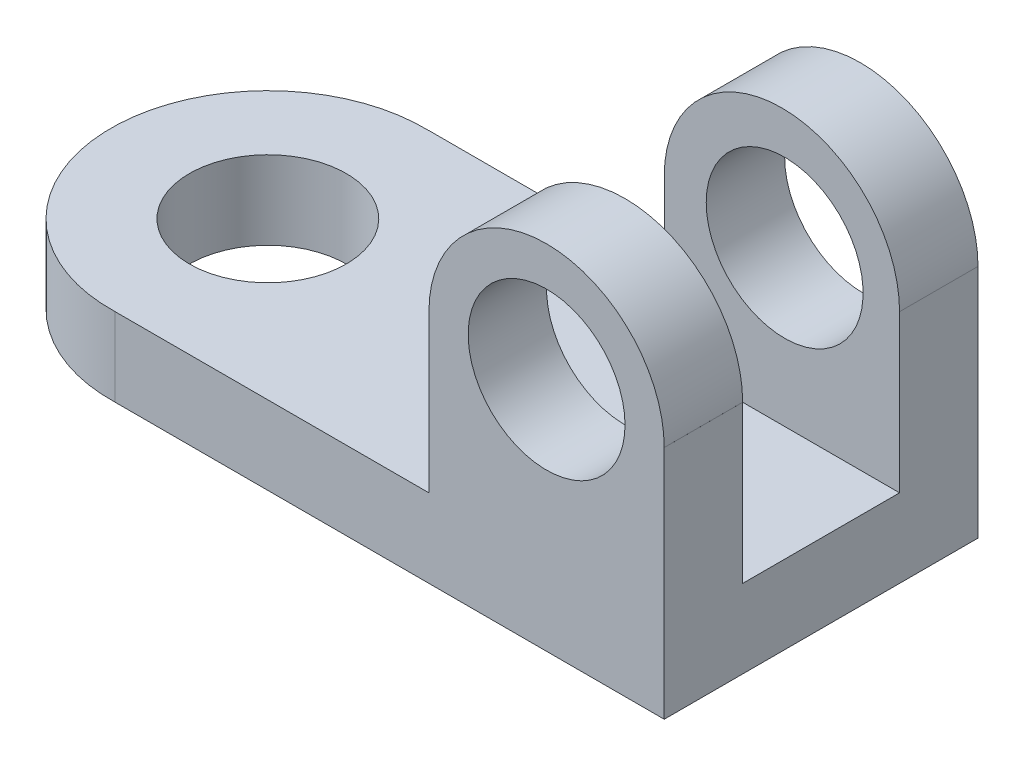
from build123d import *

# Parameters (mm, degrees)
SALIENTE_EXTRUIR2_DEPTH = 12.7
SALIENTE_EXTRUIR4_DEPTH = 12.7
CROQUIS7_R              = 12.7
CORTAR_EXTRUIR1_DEPTH   = 12.7
SALIENTE_EXTRUIR5_DEPTH = 12.7
CROQUIS9_R              = 12.7
CORTAR_EXTRUIR2_DEPTH   = 28.702
CROQUIS10_R             = 12.7
CORTAR_EXTRUIR3_DEPTH   = 32.004


with BuildPart() as part:
    # Croquis1 → Saliente-Extruir2 (new body)
    with BuildSketch(Plane(origin=(0, 0, 0), x_dir=(1, 0, 0), z_dir=(0, 1, 0))):
        with BuildLine():
            Line((0, 0), (0, 50.8))
            Line((0, 50.8), (-88.9, 50.8))
            Line((-88.9, 50.8), (-88.9, 50.782381867))
            ThreePointArc((-88.9, 50.782381867), (-114.968896843, 25.391190933), (-88.9, 0))
            Line((-88.9, 0), (0, 0))
        make_face()
    extrude(amount=SALIENTE_EXTRUIR2_DEPTH)

    # Croquis5 → Saliente-Extruir4 (add)
    with BuildSketch(Plane.XY):
        with BuildLine():
            Line((0, 12.7), (0, 38.1))
            Line((0, 38.1), (-0.002616662, 38.1))
            ThreePointArc((-0.002616662, 38.1), (-19.05, 57.147383338), (-38.097383338, 38.1))
            Line((-38.097383338, 38.1), (-38.1, 38.1))
            Line((-38.1, 38.1), (-38.1, 12.7))
            Line((-38.1, 12.7), (0, 12.7))
        make_face()
    extrude(amount=-SALIENTE_EXTRUIR4_DEPTH)

    # Croquis7 → Cortar-Extruir1 (cut)
    with BuildSketch(Plane.XY):
        with Locations((-19.05, 38.1)):
            Circle(CROQUIS7_R)
    extrude(amount=-CORTAR_EXTRUIR1_DEPTH, mode=Mode.SUBTRACT)

    # Croquis8 → Saliente-Extruir5 (add)
    with BuildSketch(Plane(origin=(0, 0, -50.8), x_dir=(-1, 0, 0), z_dir=(0, 0, -1))):
        with BuildLine():
            Line((38.1, 12.7), (38.097383338, 38.1))
            ThreePointArc((38.097383338, 38.1), (19.048691669, 57.148691669), (0, 38.1))
            Line((0, 38.1), (0, 12.7))
            Line((0, 12.7), (38.1, 12.7))
        make_face()
    extrude(amount=-SALIENTE_EXTRUIR5_DEPTH)

    # Croquis9 → Cortar-Extruir2 (cut)
    with BuildSketch(Plane(origin=(0, 0, -50.8), x_dir=(-1, 0, 0), z_dir=(0, 0, -1))):
        with Locations((18.60399445, 37.760816035)):
            Circle(CROQUIS9_R)
    extrude(amount=-CORTAR_EXTRUIR2_DEPTH, mode=Mode.SUBTRACT)

    # Croquis10 → Cortar-Extruir3 (cut)
    with BuildSketch(Plane(origin=(0, 12.7, 0), x_dir=(1, 0, 0), z_dir=(0, 1, 0))):
        with Locations(Location((-89.568896843, 25.391190933, 0), (0, 0, 270))):
            Circle(CROQUIS10_R)
    extrude(amount=-CORTAR_EXTRUIR3_DEPTH, mode=Mode.SUBTRACT)


solid = part.part
